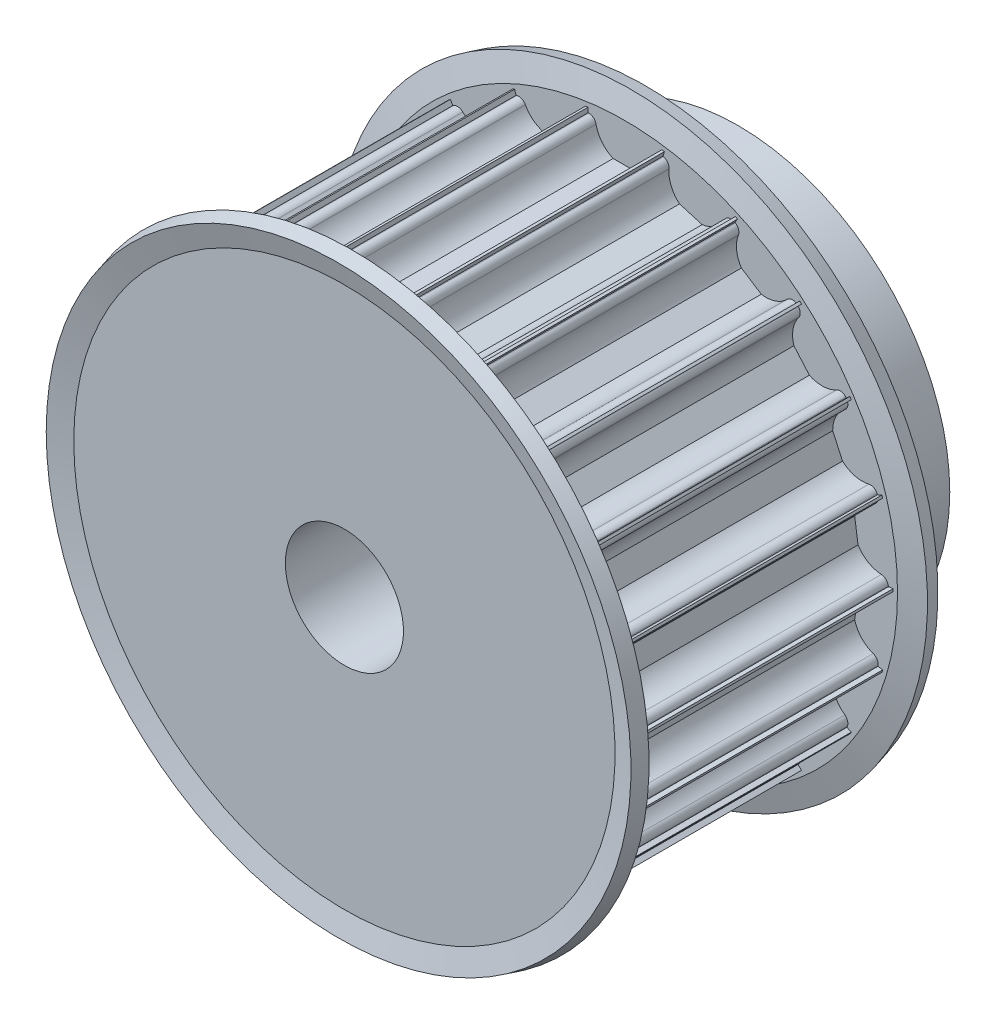
from build123d import *

# Parameters (mm, degrees)
CUT_EXTRUDE1_DEPTH = 56.543901555
CIRPATTERN1_COUNT  = 22


with BuildPart() as part:
    # Sketch1 → Revolve1 (revolve)
    with BuildSketch(Plane(origin=(0, 0, 0), x_dir=(0, 0, -1), z_dir=(1, 0, 0)), mode=Mode.PRIVATE) as revolve1_sk:
        Polygon((0, 6), (0, 27.25), (30, 27.25), (30, 21.5), (40, 21.5), (40, 6), align=None)
    revolve(revolve1_sk.sketch.rotate(Axis((0, 0, -88.99), (0, 0, 1)), 90), axis=Axis((0, 0, -88.99), (0, 0, 1)))

    # Sketch2 → Cut-Extrude1 (cut, through all)
    with BuildSketch(Plane.XY):
        with BuildLine():
            Line((3.674234614, 26.5), (3.75, 26.5))
            Line((3.75, 26.5), (3.75, 28.5))
            Line((3.75, 28.5), (-3.75, 28.5))
            Line((-3.75, 28.5), (-3.75, 26.5))
            Line((-3.75, 26.5), (-3.674234614, 26.5))
            ThreePointArc((-3.674234614, 26.5), (-3.199892965, 26.330947502), (-2.939387691, 25.9))
            ThreePointArc((-2.939387691, 25.9), (-2.331759211, 24.612435701), (-1.198957881, 23.75))
            Line((-1.198957881, 23.75), (1.198957881, 23.75))
            ThreePointArc((1.198957881, 23.75), (2.331759211, 24.612435701), (2.939387691, 25.9))
            ThreePointArc((2.939387691, 25.9), (3.199892965, 26.330947502), (3.674234614, 26.5))
        make_face()
    cut_extrude1 = extrude(amount=-CUT_EXTRUDE1_DEPTH, mode=Mode.SUBTRACT)

    # CirPattern1: Cut-Extrude1 ×22 about axis
    cirpattern1_axis = Axis((0, 0, 0), (0, 0, 1))
    for i in range(1, CIRPATTERN1_COUNT):
        add(cut_extrude1.rotate(cirpattern1_axis, i * 360 / CIRPATTERN1_COUNT), mode=Mode.SUBTRACT)

    # Sketch3 → Revolve2 (revolve)
    with BuildSketch(Plane(origin=(0, 0, 0), x_dir=(0, 0, -1), z_dir=(1, 0, 0)), mode=Mode.PRIVATE) as revolve2_sk:
        Polygon((0, 22.690739153), (1.5, 22.690739153), (1.5, 27.690739153), (0.856921938, 30.090739153), (-0.591966801, 29.702510585), (0, 27.493260406), align=None)
        Polygon((30.591966801, 29.702510585), (29.143078062, 30.090739153), (28.5, 27.690739153), (28.5, 22.690739153), (30, 22.690739153), (30, 27.493260406), align=None)
    revolve(revolve2_sk.sketch.rotate(Axis((0, 0, -88.99), (0, 0, 1)), 90), axis=Axis((0, 0, -88.99), (0, 0, 1)))


solid = part.part
